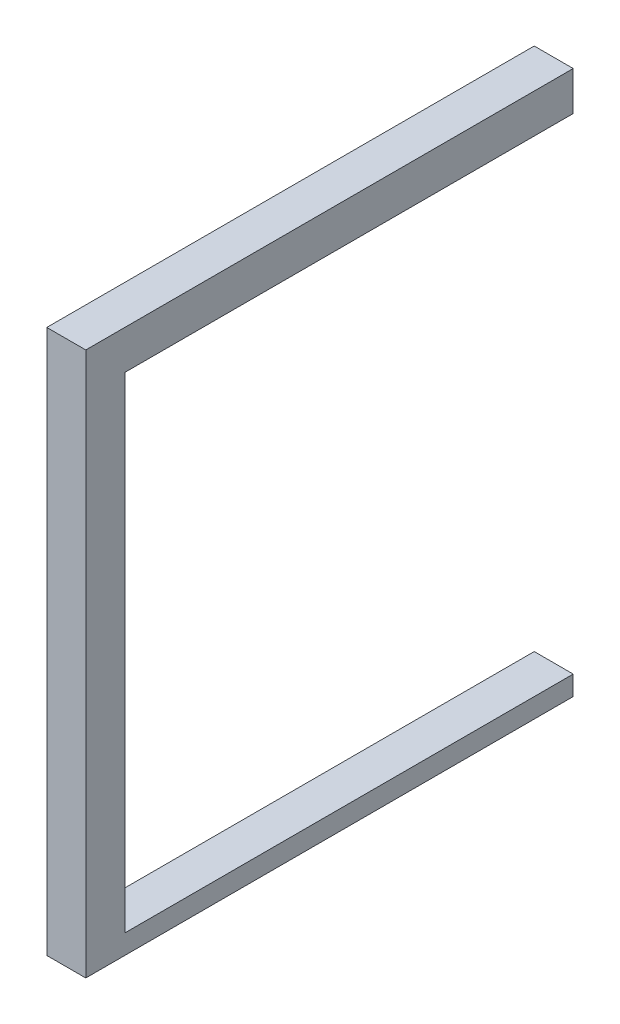
from build123d import *

# Parameters (mm, degrees)
BOSS_EXTRUDE1_DEPTH = 40


with BuildPart() as part:
    # Sketch1 → Boss-Extrude1 (new body)
    with BuildSketch(Plane(origin=(0, 0, 0), x_dir=(0, 0, -1), z_dir=(1, 0, 0))):
        Polygon((0, 0), (0, 557.936394635), (500, 557.936394635), (500, 517.936394635), (40, 517.936394635), (40, 20), (500, 20), (500, 0), align=None)
    extrude(amount=BOSS_EXTRUDE1_DEPTH)


solid = part.part
